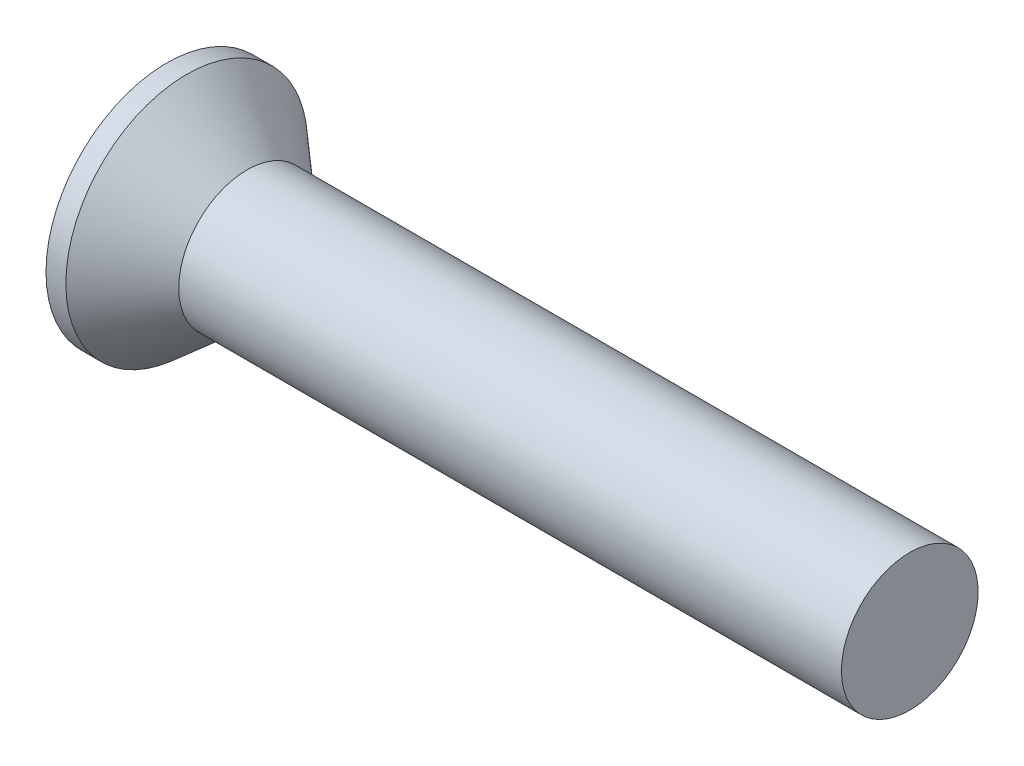
from build123d import *

# Parameters (mm, degrees)
CIRPATTERN1_COUNT = 2
CIRPATTERN1_ANGLE = 90


with BuildPart() as part:
    # BodySke → Base-Revolve (revolve)
    with BuildSketch(Plane.XY, mode=Mode.PRIVATE) as base_revolve_sk:
        Polygon((0, 0), (0, 3.0988), (0.50877405, 3.0988), (2.0574, 1.7526), (19.05, 1.7526), (19.05, 0), align=None)
    revolve(base_revolve_sk.sketch.rotate(Axis((-6.35, 0, 0), (1, 0, 0)), 90), axis=Axis((-6.35, 0, 0), (1, 0, 0)))

    # Sketch3 → Cross section 0
    with BuildSketch(Plane.ZY):
        with BuildLine():
            Line((-0.4826, 2.4765), (0.4826, 2.4765))
            Line((0.4826, 2.4765), (0.4826, -2.4765))
            Line((0.4826, -2.4765), (-0.4826, -2.4765))
            Line((-0.4826, -2.4765), (-0.4826, 2.4765))
        make_face()
    # Sketch4 → Cross section 1
    with BuildSketch(Plane.ZY.offset(-2.8702)):
        with BuildLine():
            Line((-0.2413, 0.2413), (0.2413, 0.2413))
            Line((0.2413, 0.2413), (0.2413, -0.2413))
            Line((0.2413, -0.2413), (-0.2413, -0.2413))
            Line((-0.2413, -0.2413), (-0.2413, 0.2413))
        make_face()
    cross = loft(mode=Mode.SUBTRACT)

    # CirPattern1: Cross ×2 about axis
    cirpattern1_axis = Axis((0, 0, 0), (1, 0, 0))
    for i in range(1, CIRPATTERN1_COUNT):
        add(cross.rotate(cirpattern1_axis, i * CIRPATTERN1_ANGLE / (CIRPATTERN1_COUNT - 1)), mode=Mode.SUBTRACT)


solid = part.part
